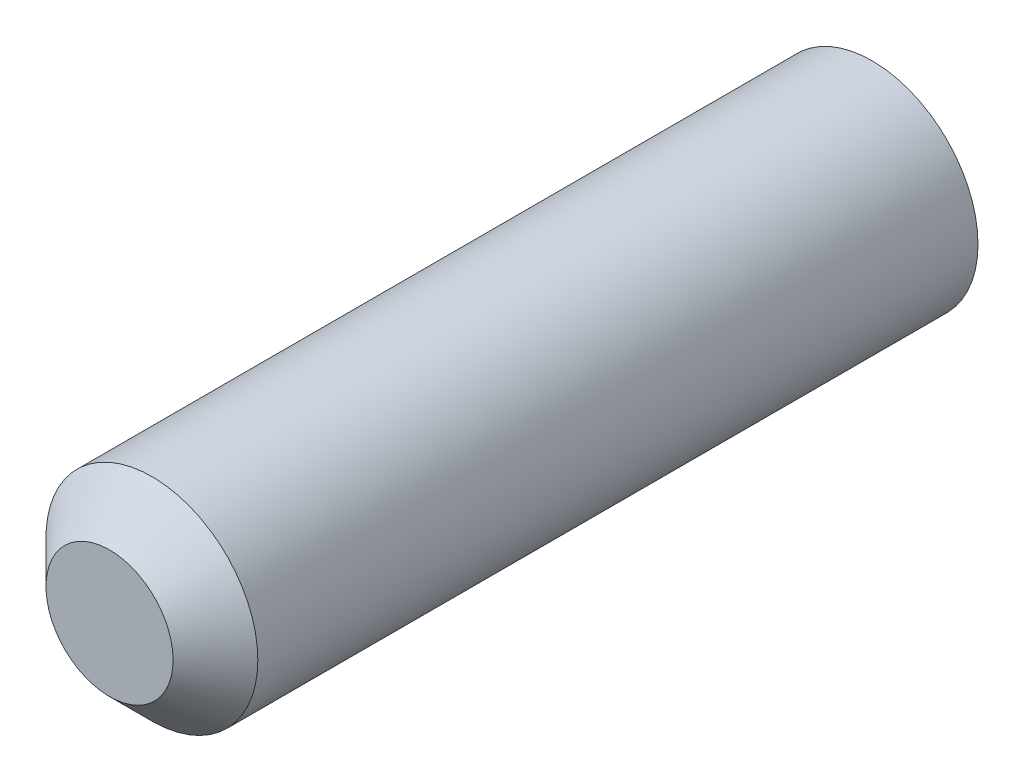
from build123d import *

# Parameters (mm, degrees)
SKETCH1_R           = 6.35
BOSS_EXTRUDE1_DEPTH = 22.86
CHAMFER1_SIZE       = 2.54
SKETCH2_R           = 1.9812
CUT_EXTRUDE1_DEPTH  = 14.2748


with BuildPart() as part:
    # Sketch1 → Boss-Extrude1 (new, symmetric)
    with BuildSketch(Plane.XY):
        Circle(SKETCH1_R)
    extrude(amount=BOSS_EXTRUDE1_DEPTH, both=True)

    # Chamfer1
    chamfer1_edges = [part.edges().sort_by_distance(p)[0] for p in [
        (-6.35, 0, 22.86),
    ]]
    chamfer(chamfer1_edges, length=CHAMFER1_SIZE)

    # Sketch2 → Cut-Extrude1 (cut)
    with BuildSketch(Plane(origin=(0, 0, -22.86), x_dir=(-1, 0, 0), z_dir=(0, 0, -1))):
        Circle(SKETCH2_R)
    extrude(amount=-CUT_EXTRUDE1_DEPTH, mode=Mode.SUBTRACT)


solid = part.part
